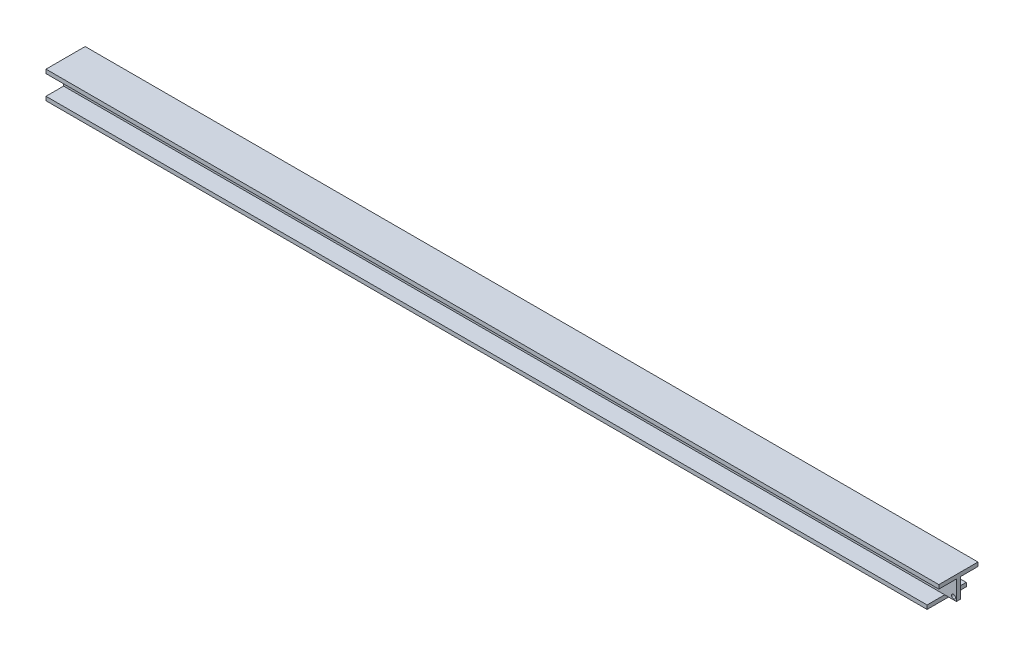
from build123d import *

# Parameters (mm, degrees)
BOSS_EXTRUDE1_DEPTH = 1930.4
CUT_EXTRUDE1_REACH  = 1943.439
SKETCH2_R           = 12.7
SKETCH3_W           = 254
SKETCH3_H           = 25.4
CUT_EXTRUDE2_DEPTH  = 76.2
BOSS_EXTRUDE2_DEPTH = 3860.8


with BuildPart() as part:
    # Sketch1 → Boss-Extrude1 (new body)
    with BuildSketch(Plane(origin=(0, 0, 0), x_dir=(0, 0, -1), z_dir=(1, 0, 0))):
        Polygon((139.7, 0), (254, 0), (254, 25.4), (0, 25.4), (0, 0), (114.3, 0), (114.3, -127), (0, -127), (0, -152.4), (254, -152.4), (254, -127), (139.7, -127), align=None)
    extrude(amount=BOSS_EXTRUDE1_DEPTH)

    # Sketch2 → Cut-Extrude1 (cut, up to next)
    with BuildSketch(Plane.XY.offset(-114.3), mode=Mode.PRIVATE) as cut_extrude1_sk1:
        with Locations((1911.35, -107.95)):
            Circle(SKETCH2_R)
    cut_extrude1_tool1 = extrude(cut_extrude1_sk1.sketch, amount=-CUT_EXTRUDE1_REACH, mode=Mode.PRIVATE) & part.part
    add(cut_extrude1_tool1.solids().sort_by_distance((1911.35, -107.95, -114.3))[0], mode=Mode.SUBTRACT)

    # Sketch3 → Cut-Extrude2 (cut)
    with BuildSketch(Plane(origin=(1930.4, 0, 0), x_dir=(0, 0, -1), z_dir=(1, 0, 0))):
        with Locations((127, -139.7)):
            Rectangle(SKETCH3_W, SKETCH3_H)
    extrude(amount=-CUT_EXTRUDE2_DEPTH, mode=Mode.SUBTRACT)

    # Sketch5 → Boss-Extrude2 (add)
    with BuildSketch(Plane.ZY):
        Polygon((-254, 25.4), (0, 25.4), (0, 0), (-114.3, 0), (-114.3, -127), (0, -127), (0, -152.4), (-254, -152.4), (-254, -127), (-139.7, -127), (-139.7, 0), (-254, 0), align=None)
    extrude(amount=BOSS_EXTRUDE2_DEPTH)


solid = part.part
